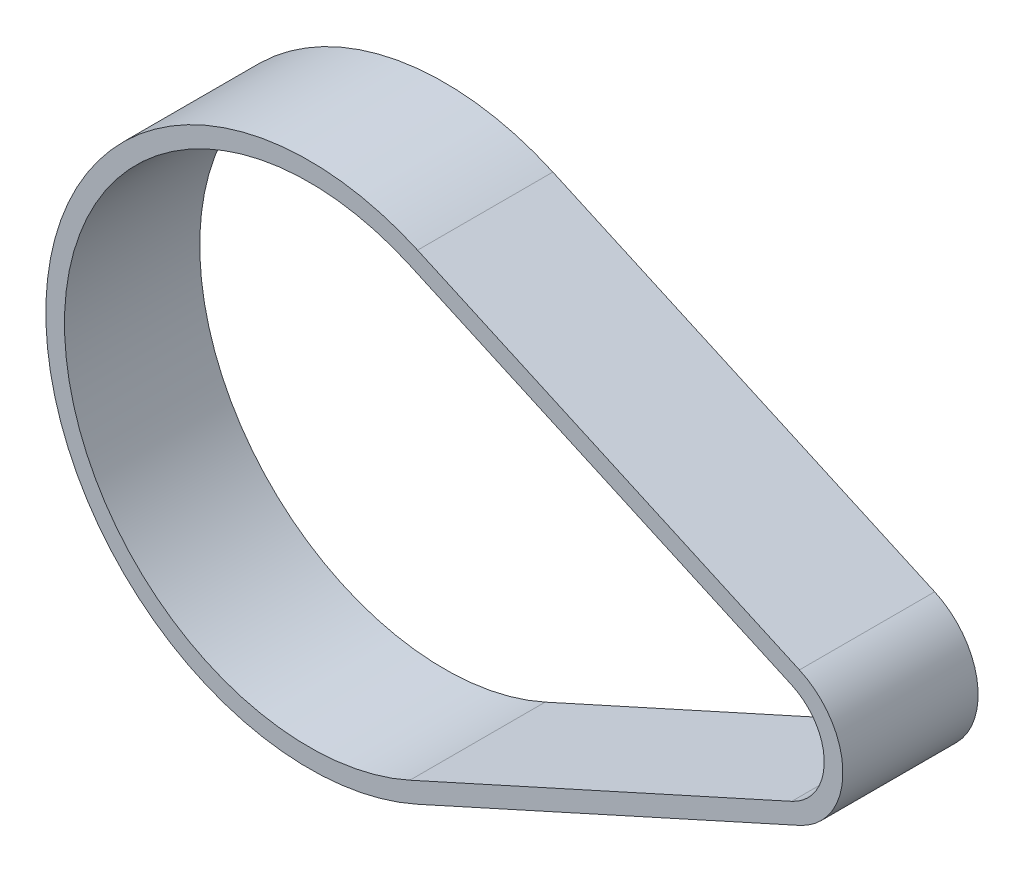
from build123d import *

# Parameters (mm, degrees)
EXTRUDE_1_DEPTH = 10


with BuildPart() as part:
    # Эскиз1 → Бобышка-Вытянуть1 (new body)
    with BuildSketch(Plane.XY):
        with BuildLine():
            Line((8.019912069, 17.740535298), (36.250564664, 4.978386487))
            ThreePointArc((36.250564664, 4.978386487), (39.463458, 0), (36.250564664, -4.978386487))
            Line((36.250564664, -4.978386487), (8.019912069, -17.740535298))
            ThreePointArc((8.019912069, -17.740535298), (-19.469093, 0), (8.019912069, 17.740535298))
        make_face()
        with BuildLine():
            Line((35.682100655, -3.720909381), (7.45144806, -16.483058192))
            ThreePointArc((7.45144806, -16.483058192), (-18.089093, 0), (7.45144806, 16.483058192))
            Line((7.45144806, 16.483058192), (35.682100655, 3.720909381))
            ThreePointArc((35.682100655, 3.720909381), (38.083458, 0), (35.682100655, -3.720909381))
        make_face(mode=Mode.SUBTRACT)
    extrude(amount=-EXTRUDE_1_DEPTH)


solid = part.part
